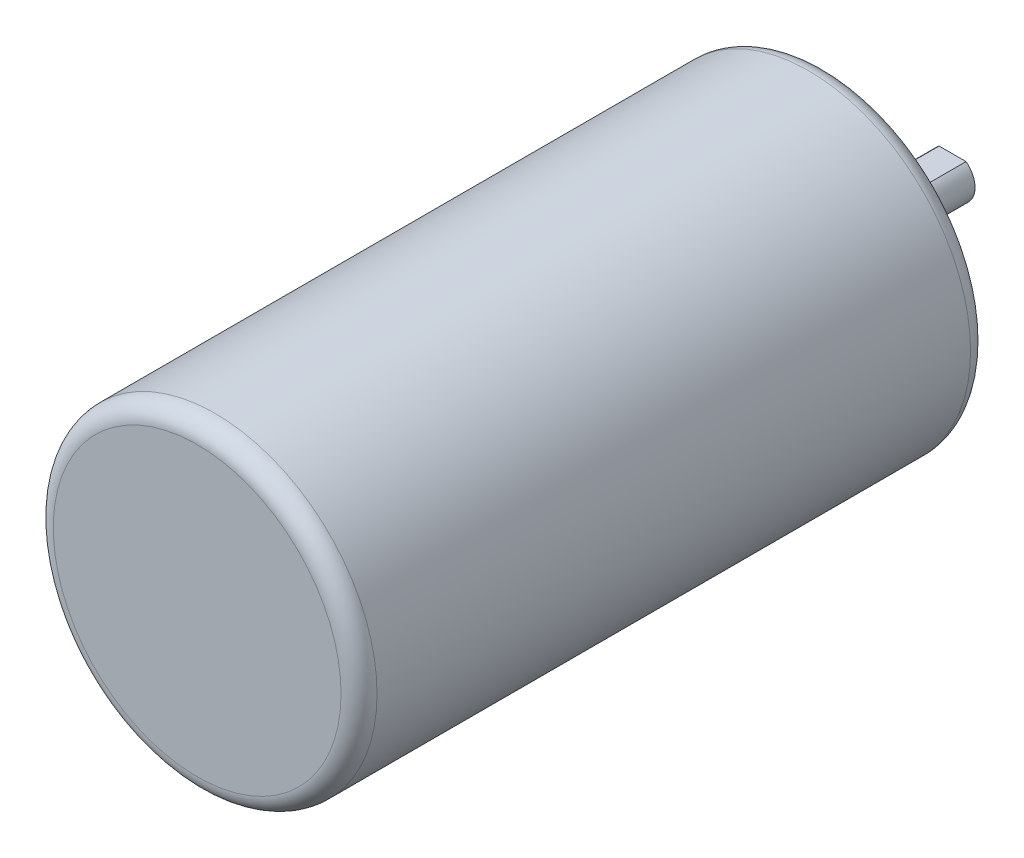
from build123d import *

# Parameters (mm, degrees)
SKETCH1_R           = 18
BOSS_EXTRUDE1_DEPTH = 70
BOSS_EXTRUDE2_DEPTH = 14
FILLET1_R           = 2
SKETCH3_R           = 1.5
CUT_EXTRUDE1_DEPTH  = 10


with BuildPart() as part:
    # Sketch1 → Boss-Extrude1 (new body)
    with BuildSketch(Plane.XY):
        Circle(SKETCH1_R)
    extrude(amount=BOSS_EXTRUDE1_DEPTH)

    # Sketch2 → Boss-Extrude2 (add)
    with BuildSketch(Plane(origin=(0, 0, 0), x_dir=(-1, 0, 0), z_dir=(0, 0, -1))):
        with BuildLine():
            Line((-1.5, 2), (1.5, 2))
            ThreePointArc((1.5, 2), (0, -2.5), (-1.5, 2))
        make_face()
    extrude(amount=BOSS_EXTRUDE2_DEPTH)

    # Fillet1
    fillet1_edges = [part.edges().sort_by_distance(p)[0] for p in [
        (-18, 0, 0),
        (-18, 0, 70),
    ]]
    fillet(fillet1_edges, radius=FILLET1_R)

    # Sketch3 → Cut-Extrude1 (cut)
    with BuildSketch(Plane(origin=(0, 0, 0), x_dir=(-1, 0, 0), z_dir=(0, 0, -1))):
        with Locations((-12.5, 0)):
            Circle(SKETCH3_R)
        with Locations((-6.25, 10.825317547)):
            Circle(SKETCH3_R)
        with Locations((6.25, 10.825317547)):
            Circle(SKETCH3_R)
        with Locations((12.5, 0)):
            Circle(SKETCH3_R)
        with Locations((6.25, -10.825317547)):
            Circle(SKETCH3_R)
        with Locations((-6.25, -10.825317547)):
            Circle(SKETCH3_R)
    extrude(amount=-CUT_EXTRUDE1_DEPTH, mode=Mode.SUBTRACT)


solid = part.part
